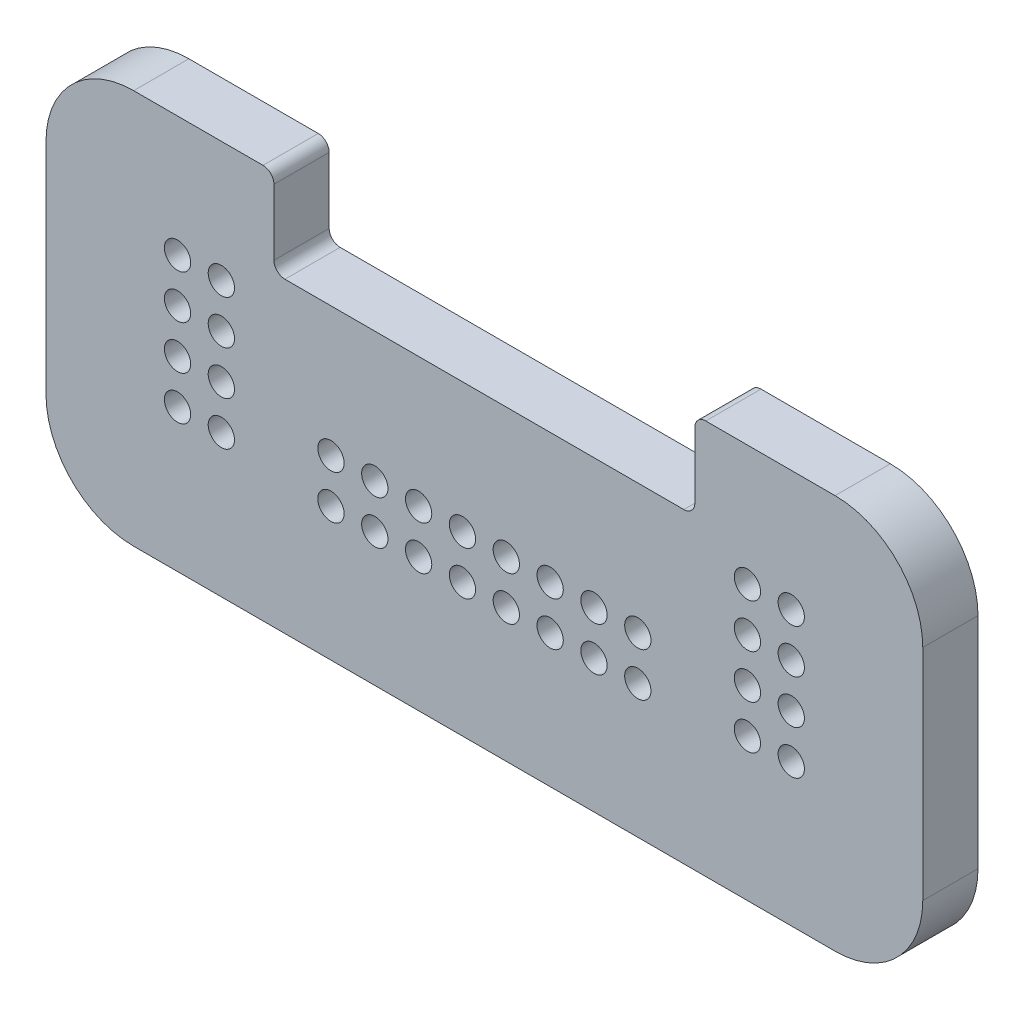
from build123d import *

# Parameters (mm, degrees)
BOSS_EXTRUDE1_DEPTH = 1.6
CUT_EXTRUDE1_DEPTH  = 15.150655683
SKETCH3_R           = 0.381
CUT_EXTRUDE2_DEPTH  = 15.150655683


with BuildPart() as part:
    # Sketch1 → Boss-Extrude1 (new body)
    with BuildSketch(Plane(origin=(0, 0, -31.8411), x_dir=(-1, 0, 0), z_dir=(0, 0, -1))):
        with BuildLine():
            Line((10.16, 5.3975), (-10.16, 5.3975))
            ThreePointArc((-10.16, 5.3975), (-11.956051224, 4.653551224), (-12.7, 2.8575))
            Line((-12.7, 2.8575), (-12.7, -3.4925))
            ThreePointArc((-12.7, -3.4925), (-11.956051224, -5.288551224), (-10.16, -6.0325))
            Line((-10.16, -6.0325), (10.16, -6.0325))
            ThreePointArc((10.16, -6.0325), (11.956051224, -5.288551224), (12.7, -3.4925))
            Line((12.7, -3.4925), (12.7, 2.8575))
            ThreePointArc((12.7, 2.8575), (11.956051224, 4.653551224), (10.16, 5.3975))
        make_face()
    extrude(amount=BOSS_EXTRUDE1_DEPTH)

    # Sketch2 → Cut-Extrude1 (cut, through all)
    with BuildSketch(Plane.XY.offset(-31.8411)):
        with BuildLine():
            Line((-5.7785, 2.8575), (5.7785, 2.8575))
            ThreePointArc((5.7785, 2.8575), (6.003006403, 2.950493597), (6.096, 3.175))
            Line((6.096, 3.175), (6.096, 5.08))
            ThreePointArc((6.096, 5.08), (6.188993597, 5.304506403), (6.4135, 5.3975))
            Line((6.4135, 5.3975), (-6.4135, 5.3975))
            ThreePointArc((-6.4135, 5.3975), (-6.188993597, 5.304506403), (-6.096, 5.08))
            Line((-6.096, 5.08), (-6.096, 3.175))
            ThreePointArc((-6.096, 3.175), (-6.003006403, 2.950493597), (-5.7785, 2.8575))
        make_face()
    extrude(amount=-CUT_EXTRUDE1_DEPTH, mode=Mode.SUBTRACT)

    # Sketch3 → Cut-Extrude2 (cut, through all)
    with BuildSketch(Plane.XY.offset(-31.8411)):
        with Locations((-7.62, 1.905)):
            Circle(SKETCH3_R)
        with Locations((-8.89, 1.905)):
            Circle(SKETCH3_R)
        with Locations((-8.89, 0.635)):
            Circle(SKETCH3_R)
        with Locations((-8.89, -0.635)):
            Circle(SKETCH3_R)
        with Locations((-8.89, -1.905)):
            Circle(SKETCH3_R)
        with Locations((-7.62, 0.635)):
            Circle(SKETCH3_R)
        with Locations((-7.62, -0.635)):
            Circle(SKETCH3_R)
        with Locations((-7.62, -1.905)):
            Circle(SKETCH3_R)
        with Locations(Location((8.89, -0.635, 0), (0, 0, 180))):
            Circle(SKETCH3_R)
        with Locations(Location((8.89, -1.905, 0), (0, 0, 180))):
            Circle(SKETCH3_R)
        with Locations(Location((7.62, -1.905, 0), (0, 0, 180))):
            Circle(SKETCH3_R)
        with Locations(Location((7.62, -0.635, 0), (0, 0, 180))):
            Circle(SKETCH3_R)
        with Locations(Location((7.62, 1.905, 0), (0, 0, 180))):
            Circle(SKETCH3_R)
        with Locations(Location((7.62, 0.635, 0), (0, 0, 180))):
            Circle(SKETCH3_R)
        with Locations(Location((8.89, 0.635, 0), (0, 0, 180))):
            Circle(SKETCH3_R)
        with Locations(Location((8.89, 1.905, 0), (0, 0, 180))):
            Circle(SKETCH3_R)
        with Locations((4.445, -2.1717)):
            Circle(SKETCH3_R)
        with Locations((3.175, -2.1717)):
            Circle(SKETCH3_R)
        with Locations((1.905, -2.1717)):
            Circle(SKETCH3_R)
        with Locations((0.635, -2.1717)):
            Circle(SKETCH3_R)
        with Locations((-0.635, -2.1717)):
            Circle(SKETCH3_R)
        with Locations((-1.905, -2.1717)):
            Circle(SKETCH3_R)
        with Locations((-3.175, -2.1717)):
            Circle(SKETCH3_R)
        with Locations((-4.445, -2.1717)):
            Circle(SKETCH3_R)
        with Locations((3.175, -0.9017)):
            Circle(SKETCH3_R)
        with Locations((1.905, -0.9017)):
            Circle(SKETCH3_R)
        with Locations((0.635, -0.9017)):
            Circle(SKETCH3_R)
        with Locations((-0.635, -0.9017)):
            Circle(SKETCH3_R)
        with Locations((-1.905, -0.9017)):
            Circle(SKETCH3_R)
        with Locations((-3.175, -0.9017)):
            Circle(SKETCH3_R)
        with Locations((-4.445, -0.9017)):
            Circle(SKETCH3_R)
        with Locations((4.445, -0.9017)):
            Circle(SKETCH3_R)
    extrude(amount=-CUT_EXTRUDE2_DEPTH, mode=Mode.SUBTRACT)


solid = part.part
